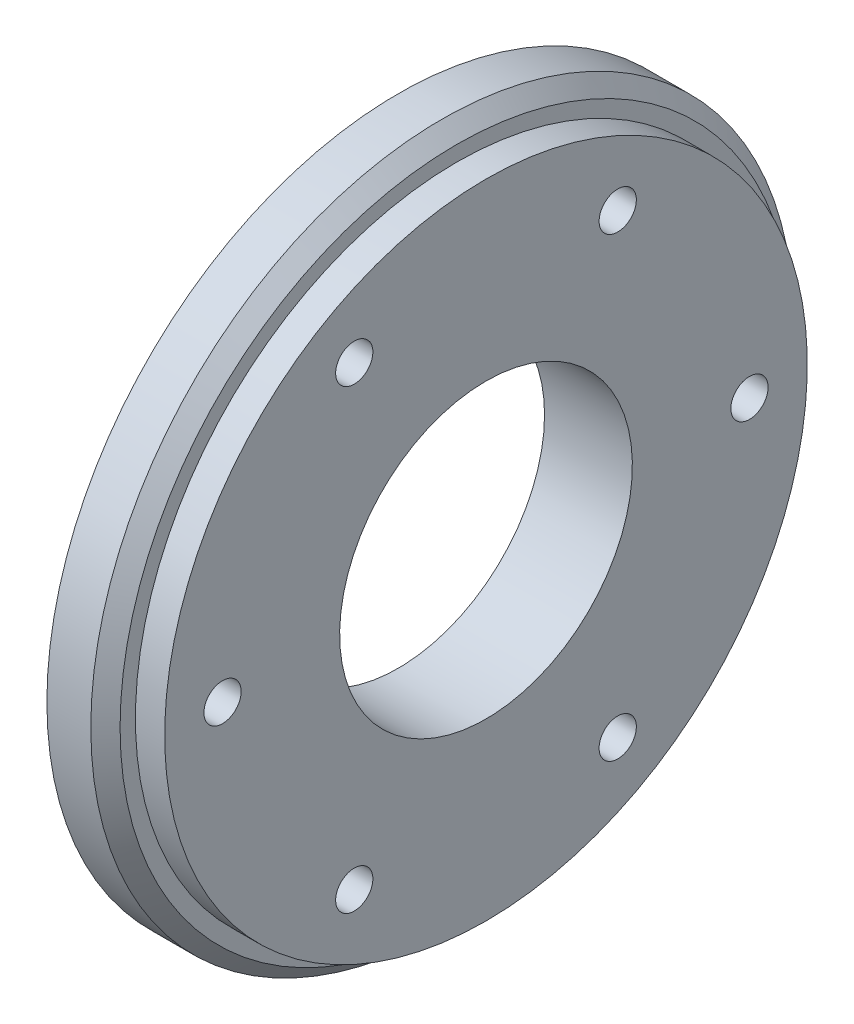
from build123d import *

# Parameters (mm, degrees)
SKETCH1_R           = 38.1
SKETCH1_R_2         = 15.875
SKETCH1_R_3         = 2.0193
BOSS_EXTRUDE1_DEPTH = 3.175
SKETCH2_R           = 34.8488
SKETCH2_R_2         = 15.875
SKETCH2_R_3         = 2.0193
BOSS_EXTRUDE2_DEPTH = 3.175
CHAMFER1_SIZE       = 1.5875


with BuildPart() as part:
    # Sketch1 → Boss-Extrude1 (new, symmetric)
    with BuildSketch(Plane(origin=(0, 0, 0), x_dir=(0, 0, -1), z_dir=(1, 0, 0))):
        Circle(SKETCH1_R)
        Circle(SKETCH1_R_2, mode=Mode.SUBTRACT)
        with Locations((14.2875, 24.746675913)):
            Circle(SKETCH1_R_3, mode=Mode.SUBTRACT)
        with Locations((28.575, 0)):
            Circle(SKETCH1_R_3, mode=Mode.SUBTRACT)
        with Locations((14.2875, -24.746675913)):
            Circle(SKETCH1_R_3, mode=Mode.SUBTRACT)
        with Locations((-14.2875, -24.746675913)):
            Circle(SKETCH1_R_3, mode=Mode.SUBTRACT)
        with Locations((-28.575, 0)):
            Circle(SKETCH1_R_3, mode=Mode.SUBTRACT)
        with Locations((-14.2875, 24.746675913)):
            Circle(SKETCH1_R_3, mode=Mode.SUBTRACT)
    extrude(amount=BOSS_EXTRUDE1_DEPTH, both=True)

    # Sketch2 → Boss-Extrude2 (add)
    with BuildSketch(Plane(origin=(3.175, 0, 0), x_dir=(0, 0, -1), z_dir=(1, 0, 0))):
        with Locations(Location((0, 0, 0), (0, 0, 90))):
            Circle(SKETCH2_R)
        with Locations(Location((0, 0, 0), (0, 0, 90))):
            Circle(SKETCH2_R_2, mode=Mode.SUBTRACT)
        with Locations(Location((-28.575, 0, 0), (0, 0, 90))):
            Circle(SKETCH2_R_3, mode=Mode.SUBTRACT)
        with Locations(Location((-14.2875, 24.746675913, 0), (0, 0, 90))):
            Circle(SKETCH2_R_3, mode=Mode.SUBTRACT)
        with Locations(Location((14.2875, 24.746675913, 0), (0, 0, 90))):
            Circle(SKETCH2_R_3, mode=Mode.SUBTRACT)
        with Locations(Location((28.575, 0, 0), (0, 0, 90))):
            Circle(SKETCH2_R_3, mode=Mode.SUBTRACT)
        with Locations(Location((14.2875, -24.746675913, 0), (0, 0, 90))):
            Circle(SKETCH2_R_3, mode=Mode.SUBTRACT)
        with Locations(Location((-14.2875, -24.746675913, 0), (0, 0, 90))):
            Circle(SKETCH2_R_3, mode=Mode.SUBTRACT)
    extrude(amount=BOSS_EXTRUDE2_DEPTH)

    # Chamfer1
    chamfer1_edges = [part.edges().sort_by_distance(p)[0] for p in [
        (3.175, 0, 38.1),
    ]]
    chamfer(chamfer1_edges, length=CHAMFER1_SIZE)


solid = part.part
